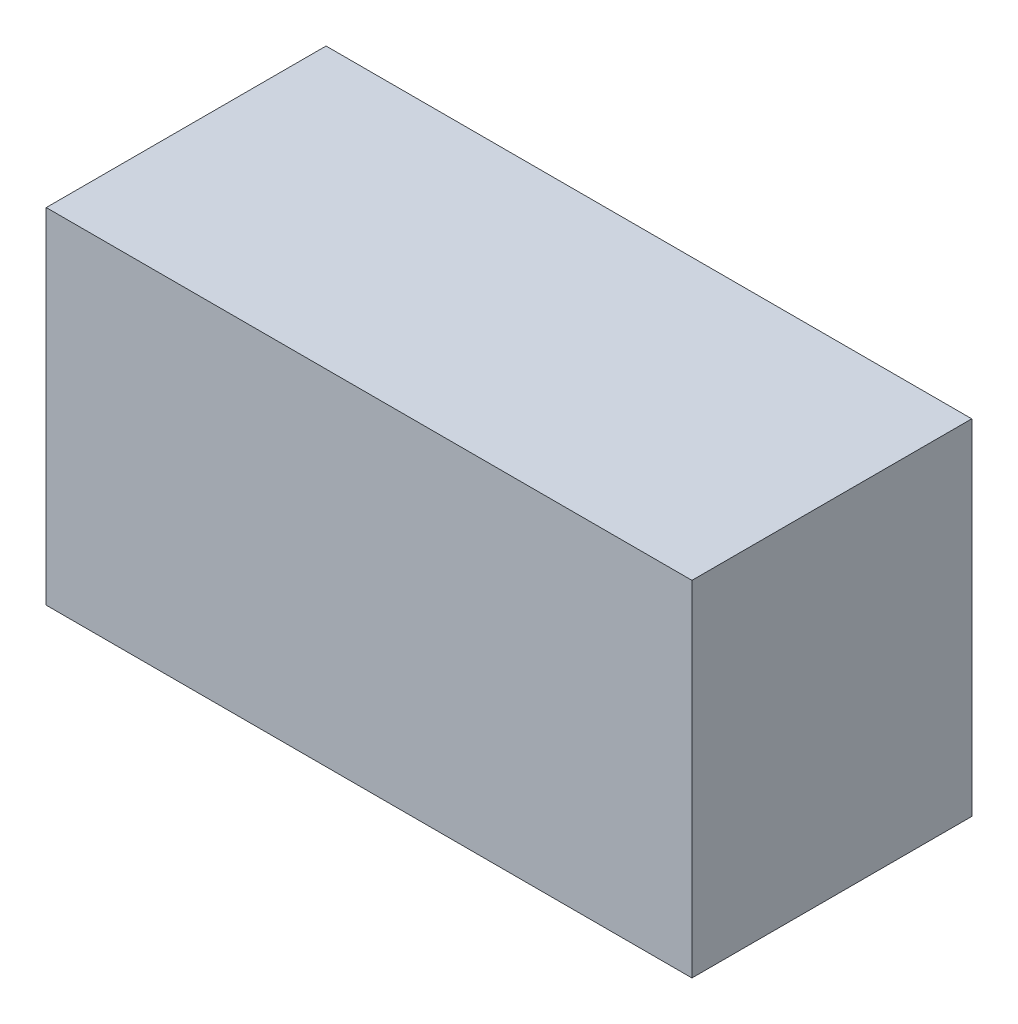
from build123d import *

# Parameters (mm, degrees)
SKETCH_1_W      = 60
SKETCH_1_H      = 32
EXTRUDE_1_DEPTH = 26


with BuildPart() as part:
    # 草图1 → 凸台-拉伸1 (new body)
    with BuildSketch(Plane.XY):
        Rectangle(SKETCH_1_W, SKETCH_1_H)
    extrude(amount=EXTRUDE_1_DEPTH)


solid = part.part
